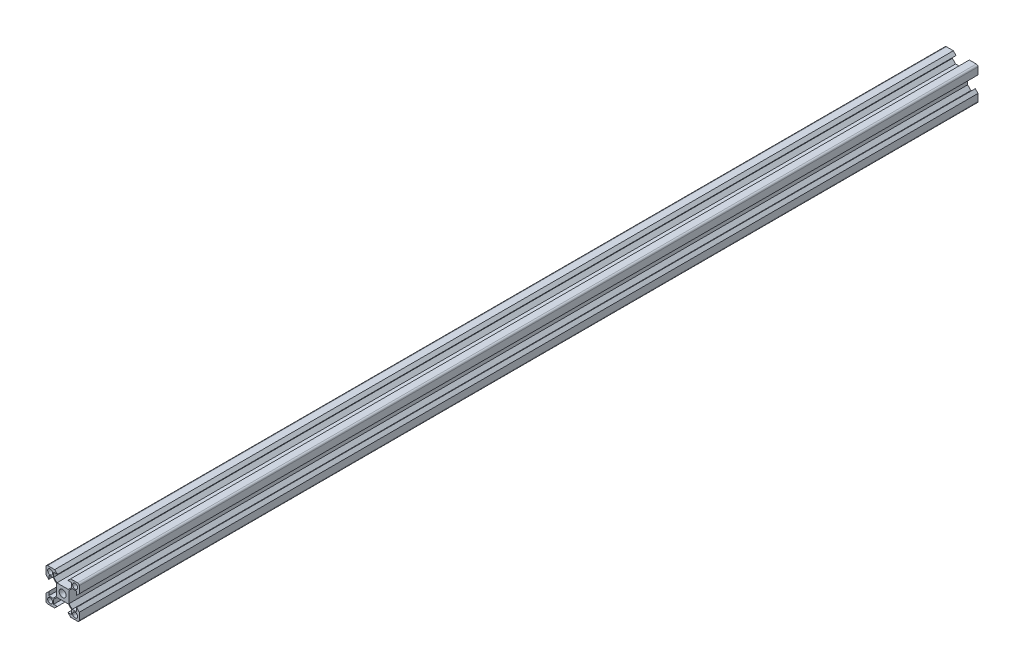
from build123d import *

# Parameters (mm, degrees)
SKETCH_1_R      = 1.5
SKETCH_1_R_2    = 2.1
EXTRUDE_1_DEPTH = 270
FILLET_1_R      = 1


with BuildPart() as part:
    # 草图1 → 凸台-拉伸1 (new, symmetric)
    with BuildSketch(Plane.XY):
        Polygon((-10, 10), (-10, 4.8), (-8.34, 3.14), (-8.34, 5.4), (-5.753553391, 5.4), (-3.8, 3.446446609), (-3.8, -3.446446609), (-5.753553391, -5.4), (-8.34, -5.4), (-8.34, -3.14), (-10, -4.8), (-10, -10), (-4.8, -10), (-3.14, -8.34), (-5.4, -8.34), (-5.4, -5.753553391), (-3.446446609, -3.8), (3.446446609, -3.8), (5.4, -5.753553391), (5.4, -8.34), (3.14, -8.34), (4.8, -10), (10, -10), (10, -4.8), (8.34, -3.14), (8.34, -5.4), (5.753553391, -5.4), (3.8, -3.446446609), (3.8, 3.446446609), (5.753553391, 5.4), (8.34, 5.4), (8.34, 3.14), (10, 4.8), (10, 10), (4.8, 10), (3.14, 8.34), (5.4, 8.34), (5.4, 5.753553391), (3.446446609, 3.8), (-3.446446609, 3.8), (-5.4, 5.753553391), (-5.4, 8.34), (-3.14, 8.34), (-4.8, 10), align=None)
        with Locations((-7.5, 7.5)):
            Circle(SKETCH_1_R, mode=Mode.SUBTRACT)
        Circle(SKETCH_1_R_2, mode=Mode.SUBTRACT)
        with Locations(Location((-7.5, -7.5, 0), (0, 0, 180))):
            Circle(SKETCH_1_R, mode=Mode.SUBTRACT)
        with Locations((7.5, -7.5)):
            Circle(SKETCH_1_R, mode=Mode.SUBTRACT)
        with Locations(Location((7.5, 7.5, 0), (0, 0, 180))):
            Circle(SKETCH_1_R, mode=Mode.SUBTRACT)
    extrude(amount=EXTRUDE_1_DEPTH, both=True)

    # 圆角1
    fillet_1_edges = [part.edges().sort_by_distance(p)[0] for p in [
        (10, 10, 0),
        (10, -10, 0),
        (-10, -10, 0),
        (-10, 10, 0),
    ]]
    fillet(fillet_1_edges, radius=FILLET_1_R)


solid = part.part
